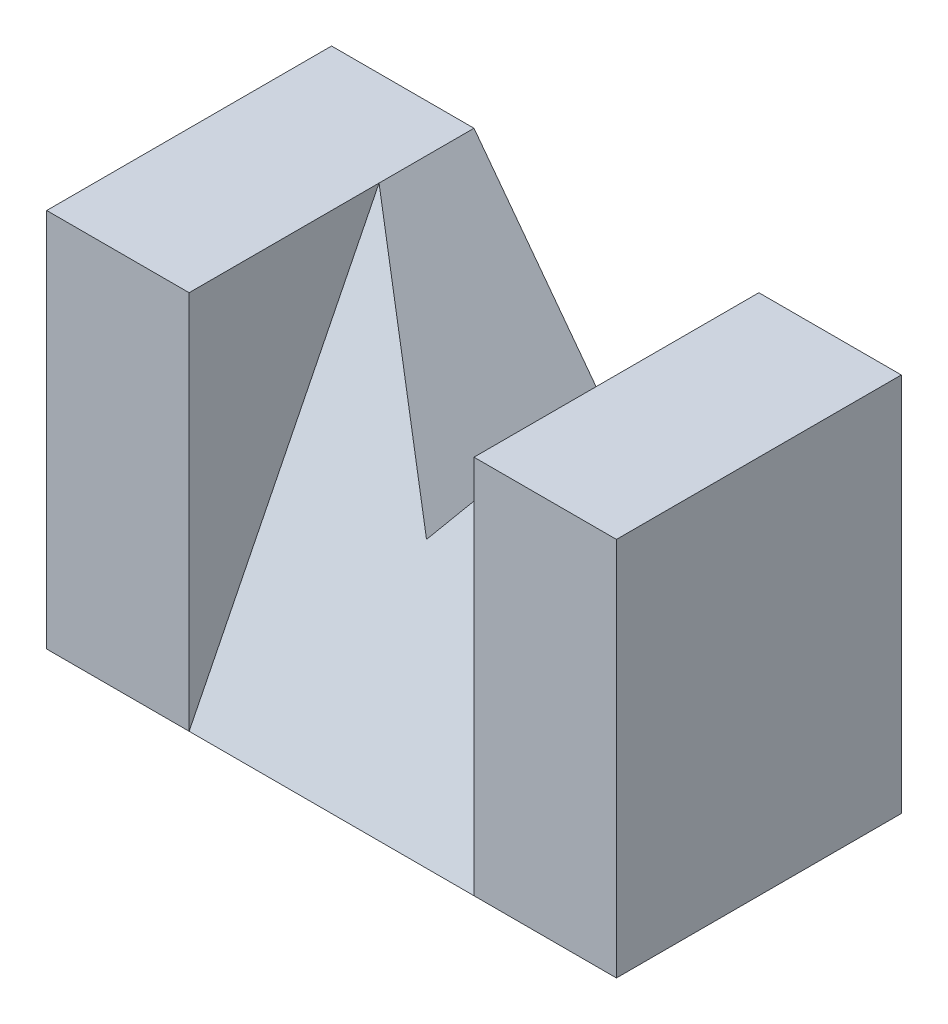
from build123d import *

# Parameters (mm, degrees)
SKETCH_1_W          = 60
SKETCH_1_H          = 30
EXTRUDE_1_DEPTH     = 40
CUT_EXTRUDE_1_DEPTH = 59.309518948
CUT_EXTRUDE_2_DEPTH = 15


with BuildPart() as part:
    # 草圖1 → 填料-伸長1 (new body)
    with BuildSketch(Plane(origin=(0, 0, 0), x_dir=(1, 0, 0), z_dir=(0, 1, 0))):
        with Locations((0, 15)):
            Rectangle(SKETCH_1_W, SKETCH_1_H)
    extrude(amount=EXTRUDE_1_DEPTH)

    # 草圖3 → 除料-伸長1 (cut, through all)
    with BuildSketch(Plane.XY):
        Polygon((-15, 40), (0, 20), (15, 40), align=None)
    extrude(amount=-CUT_EXTRUDE_1_DEPTH, mode=Mode.SUBTRACT)

    # 草圖4 → 除料-伸長2 (cut, symmetric)
    with BuildSketch(Plane(origin=(0, 0, 0), x_dir=(0, 0, -1), z_dir=(1, 0, 0))):
        Polygon((0, 40), (20, 40), (0, 0), align=None)
    extrude(amount=CUT_EXTRUDE_2_DEPTH, both=True, mode=Mode.SUBTRACT)


solid = part.part
